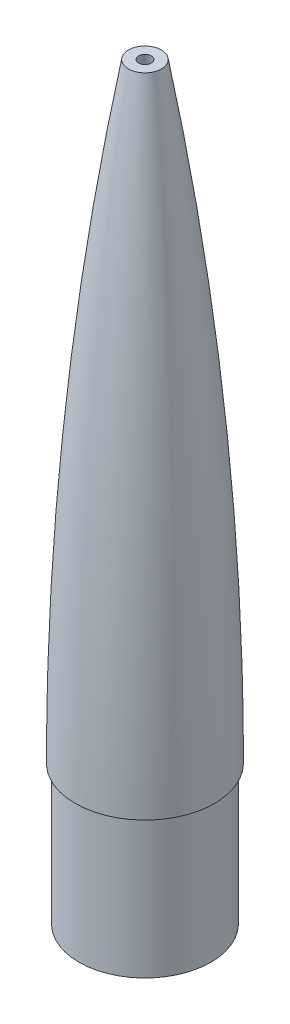
from build123d import *


with BuildPart() as part:
    # Sketch1 → Revolve3 (revolve)
    with BuildSketch(Plane.XY, mode=Mode.PRIVATE) as revolve3_sk:
        with BuildLine():
            Line((-17.399, 0), (-17.399, -40.64))
            Line((-17.399, -40.64), (-19.269565144, -40.64))
            Line((-19.269565144, -40.64), (-19.269565144, 0))
            Line((-19.269565144, 0), (-20.32, 0))
            ThreePointArc((-20.32, 0), (-16.432425265, 89.23807563), (-4.799156969, 177.8))
            Line((-4.799156969, 177.8), (-1.833166816, 177.8))
            ThreePointArc((-1.833166816, 177.8), (-13.500113667, 89.240034686), (-17.399, 0))
        make_face()
    revolve(revolve3_sk.sketch.rotate(Axis((0, 203.2, 0), (0, -1, 0)), 270), axis=Axis((0, 203.2, 0), (0, -1, 0)))


solid = part.part
